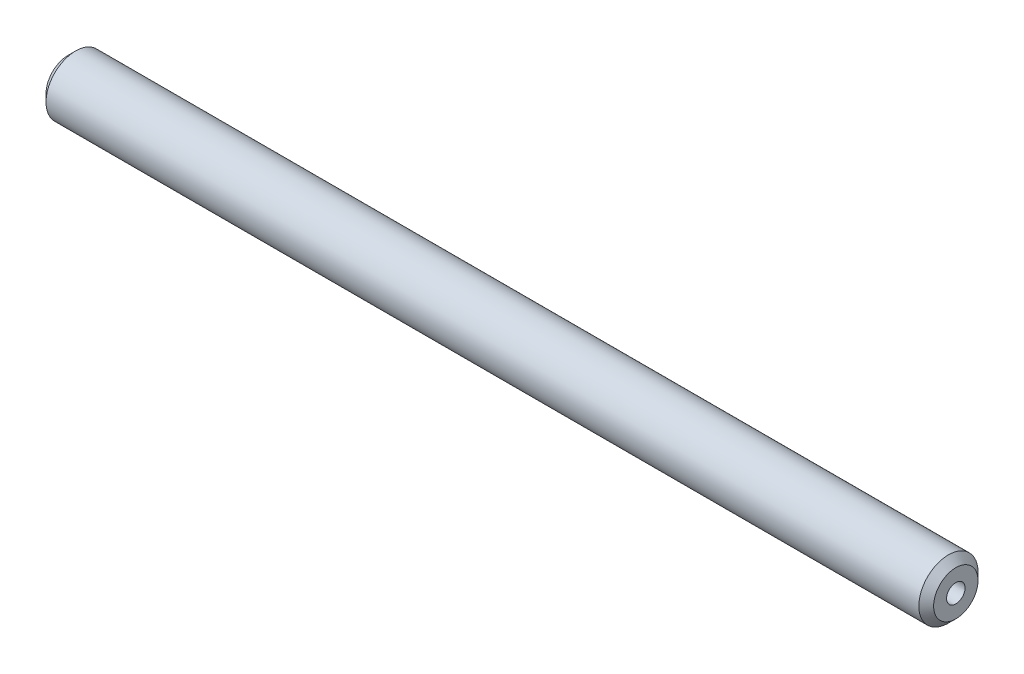
from build123d import *

# Parameters (mm, degrees)
ESQUISSE1_R           = 4
BOSS_EXTRU_1_DEPTH    = 60
CHANFREIN1_SIZE       = 1
TROU_TARAUD_M31_D     = 2.5
TROU_TARAUD_M31_DEPTH = 8.5
TROU_TARAUD_M31_TIP   = 0.751075774
TROU_TARAUD_M32_D     = 2.5
TROU_TARAUD_M32_DEPTH = 8.5
TROU_TARAUD_M32_TIP   = 0.751075774


with BuildPart() as part:
    # Esquisse1 → Boss.-Extru.1 (new, symmetric)
    with BuildSketch(Plane(origin=(0, 0, 0), x_dir=(0, 0, -1), z_dir=(1, 0, 0))):
        Circle(ESQUISSE1_R)
    extrude(amount=BOSS_EXTRU_1_DEPTH, both=True)

    # Chanfrein1
    chanfrein1_edges = [part.edges().sort_by_distance(p)[0] for p in [
        (-60, 0, 4),
        (60, 0, 4),
    ]]
    chamfer(chanfrein1_edges, length=CHANFREIN1_SIZE)

    # Trou taraudé M31
    with Locations(Plane(origin=(60, 0, 0), x_dir=(0, 0, -1), z_dir=(1, 0, 0))):
        with Locations((0, 0)):
            Hole(TROU_TARAUD_M31_D / 2, depth=TROU_TARAUD_M31_DEPTH)
            with Locations((0, 0, -(TROU_TARAUD_M31_DEPTH + TROU_TARAUD_M31_TIP / 2))):  # 118° drill point
                Cone(0, TROU_TARAUD_M31_D / 2, TROU_TARAUD_M31_TIP, mode=Mode.SUBTRACT)

    # Trou taraudé M32
    with Locations(Plane.ZY.offset(60)):
        with Locations((0, 0)):
            Hole(TROU_TARAUD_M32_D / 2, depth=TROU_TARAUD_M32_DEPTH)
            with Locations((0, 0, -(TROU_TARAUD_M32_DEPTH + TROU_TARAUD_M32_TIP / 2))):  # 118° drill point
                Cone(0, TROU_TARAUD_M32_D / 2, TROU_TARAUD_M32_TIP, mode=Mode.SUBTRACT)


solid = part.part
